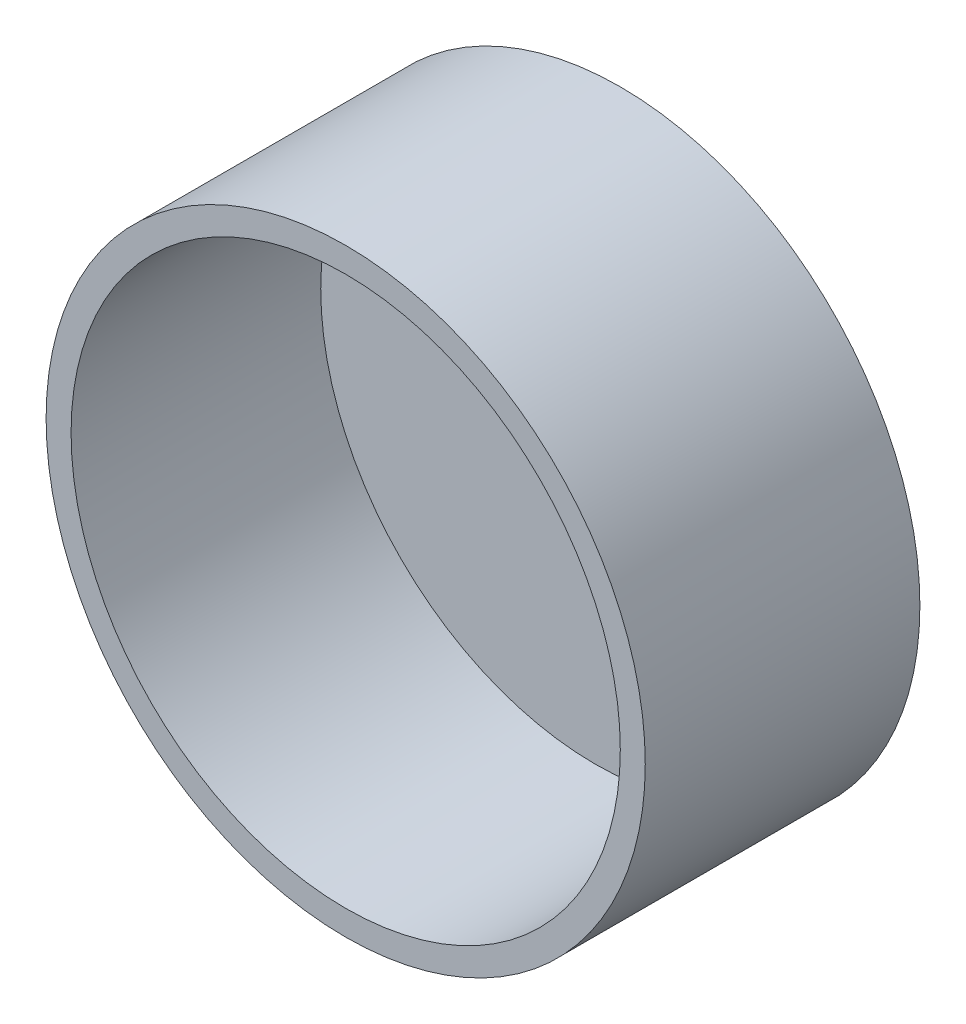
from build123d import *

# Parameters (mm, degrees)
SKETCH1_R           = 27.94
BOSS_EXTRUDE1_DEPTH = 25.4
SHELL1_T            = 2.54


with BuildPart() as part:
    # Sketch1 → Boss-Extrude1 (new body)
    with BuildSketch(Plane.XY):
        with Locations(Location((0, 0, 0), (0, 0, 180))):
            Circle(SKETCH1_R)
    extrude(amount=BOSS_EXTRUDE1_DEPTH)

    # Shell1
    shell1_openings = [part.faces().sort_by_distance(p)[0] for p in [
        (0, 0, 25.4),
    ]]
    offset(amount=SHELL1_T, openings=shell1_openings, kind=Kind.INTERSECTION)


solid = part.part
